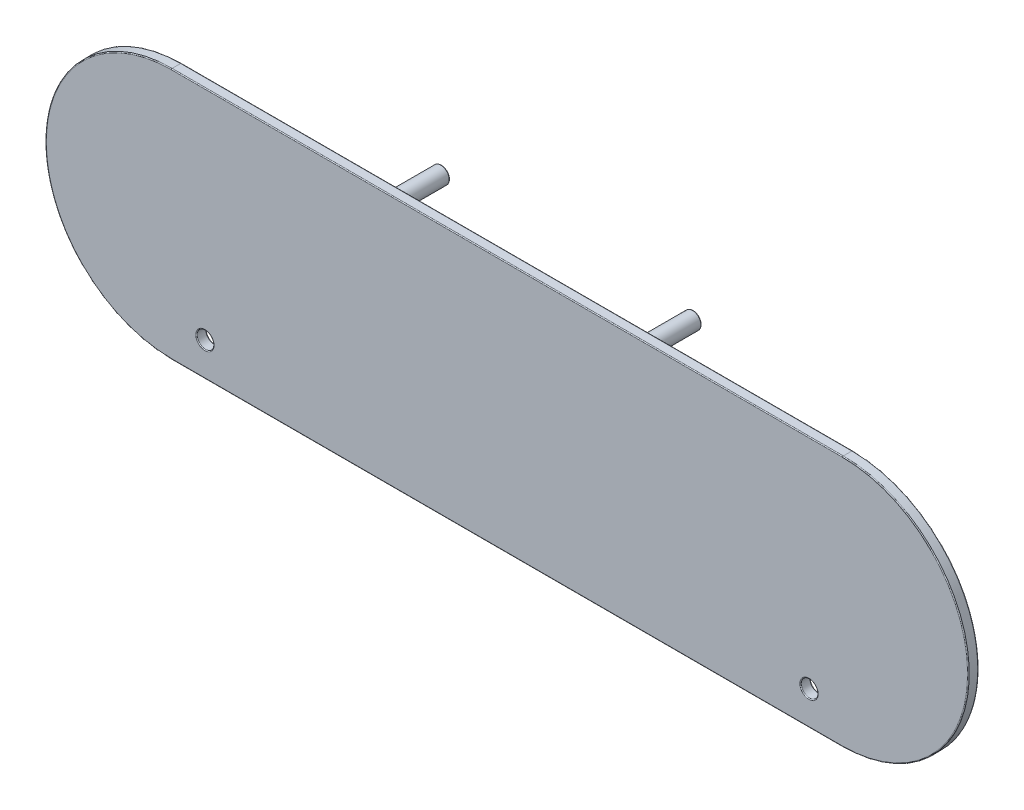
from build123d import *

# Parameters (mm, degrees)
SKETCH1_R           = 2.5
BOSS_EXTRUDE2_DEPTH = 3
SKETCH1_4_R         = 2.5
SKETCH1_4_R_2       = 0.25
EXTRUDE_THIN1_DEPTH = 15
FILLET2_R           = 0.25
FILLET3_R           = 0.25


with BuildPart() as part:
    # Sketch1 → Boss-Extrude2 (new body)
    with BuildSketch(Plane.XY):
        with BuildLine():
            Line((100, 37.5), (-100, 37.5))
            ThreePointArc((-100, 37.5), (-137.5, 0), (-100, -37.5))
            Line((-100, -37.5), (100, -37.5))
            ThreePointArc((100, -37.5), (137.5, 0), (100, 37.5))
        make_face()
        with Locations((-90, -27.5)):
            Circle(SKETCH1_R, mode=Mode.SUBTRACT)
        with Locations((90, -27.5)):
            Circle(SKETCH1_R, mode=Mode.SUBTRACT)
    extrude(amount=BOSS_EXTRUDE2_DEPTH)

    # Sketch1<4> → Extrude-Thin1 (add)
    # profile 1 of 4: a face of its own
    with BuildSketch(Plane.XY):
        with Locations((75, -32.5)):
            Circle(SKETCH1_4_R)
        with Locations((75, -32.5)):
            Circle(SKETCH1_4_R_2, mode=Mode.SUBTRACT)
    # profile 2 of 4: a face of its own
    with BuildSketch(Plane.XY):
        with Locations((37.5, 32.5)):
            Circle(SKETCH1_4_R)
        with Locations((37.5, 32.5)):
            Circle(SKETCH1_4_R_2, mode=Mode.SUBTRACT)
    # profile 3 of 4: a face of its own
    with BuildSketch(Plane.XY):
        with Locations((-75, -32.5)):
            Circle(SKETCH1_4_R)
        with Locations((-75, -32.5)):
            Circle(SKETCH1_4_R_2, mode=Mode.SUBTRACT)
    # profile 4 of 4: a face of its own
    with BuildSketch(Plane.XY):
        with Locations((-37.5, 32.5)):
            Circle(SKETCH1_4_R)
        with Locations((-37.5, 32.5)):
            Circle(SKETCH1_4_R_2, mode=Mode.SUBTRACT)
    extrude(amount=-EXTRUDE_THIN1_DEPTH)

    # Fillet2
    fillet2_edges = [part.edges().sort_by_distance(p)[0] for p in [
        (0, -37.5, 0),
        (-137.5, 0, 0),
        (0, 37.5, 0),
        (-92.5, -27.5, 3),
        (87.5, -27.5, 3),
        (-137.5, 0, 3),
        (0, 37.5, 3),
        (137.5, 0, 3),
        (0, -37.5, 3),
        (72.5, -32.5, -15),
        (74.75, -32.5, -15),
        (-75.25, -32.5, -15),
        (-77.5, -32.5, -15),
        (-37.75, 32.5, -15),
        (-40, 32.5, -15),
        (35, 32.5, -15),
        (37.25, 32.5, -15),
        (137.5, 0, 0),
    ]]
    fillet(fillet2_edges, radius=FILLET2_R)

    # Fillet3
    fillet3_edges = [part.edges().sort_by_distance(p)[0] for p in [
        (-92.5, -27.5, 0),
        (87.5, -27.5, 0),
        (35, 32.5, 0),
        (-40, 32.5, 0),
        (-77.5, -32.5, 0),
        (72.5, -32.5, 0),
    ]]
    fillet(fillet3_edges, radius=FILLET3_R)


solid = part.part
